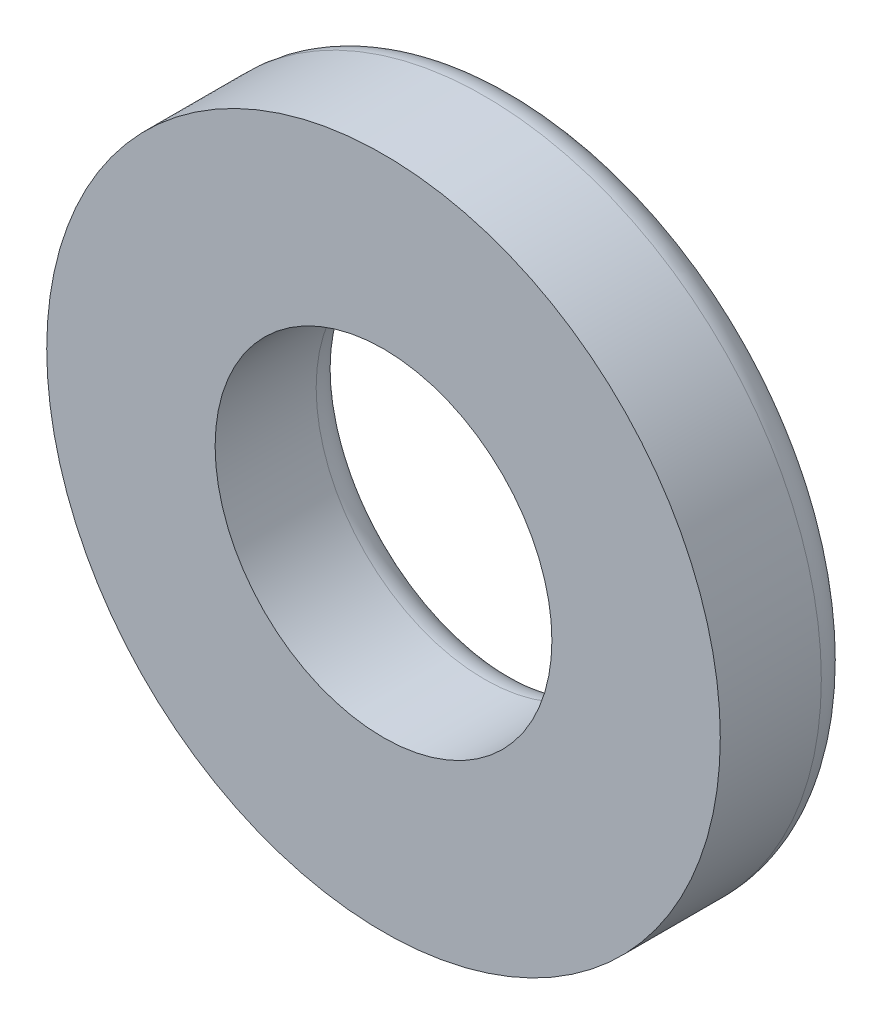
from build123d import *

# Parameters (mm, degrees)
SKETCH1_R           = 30
SKETCH1_R_2         = 15
BOSS_EXTRUDE1_DEPTH = 12
FILLET1_R           = 3


with BuildPart() as part:
    # Sketch1 → Boss-Extrude1 (new body)
    with BuildSketch(Plane.XY):
        Circle(SKETCH1_R)
        Circle(SKETCH1_R_2, mode=Mode.SUBTRACT)
    extrude(amount=BOSS_EXTRUDE1_DEPTH)

    # Fillet1
    fillet1_edges = [part.edges().sort_by_distance(p)[0] for p in [
        (-30, 0, 0),
        (-15, 0, 0),
    ]]
    fillet(fillet1_edges, radius=FILLET1_R)


solid = part.part
